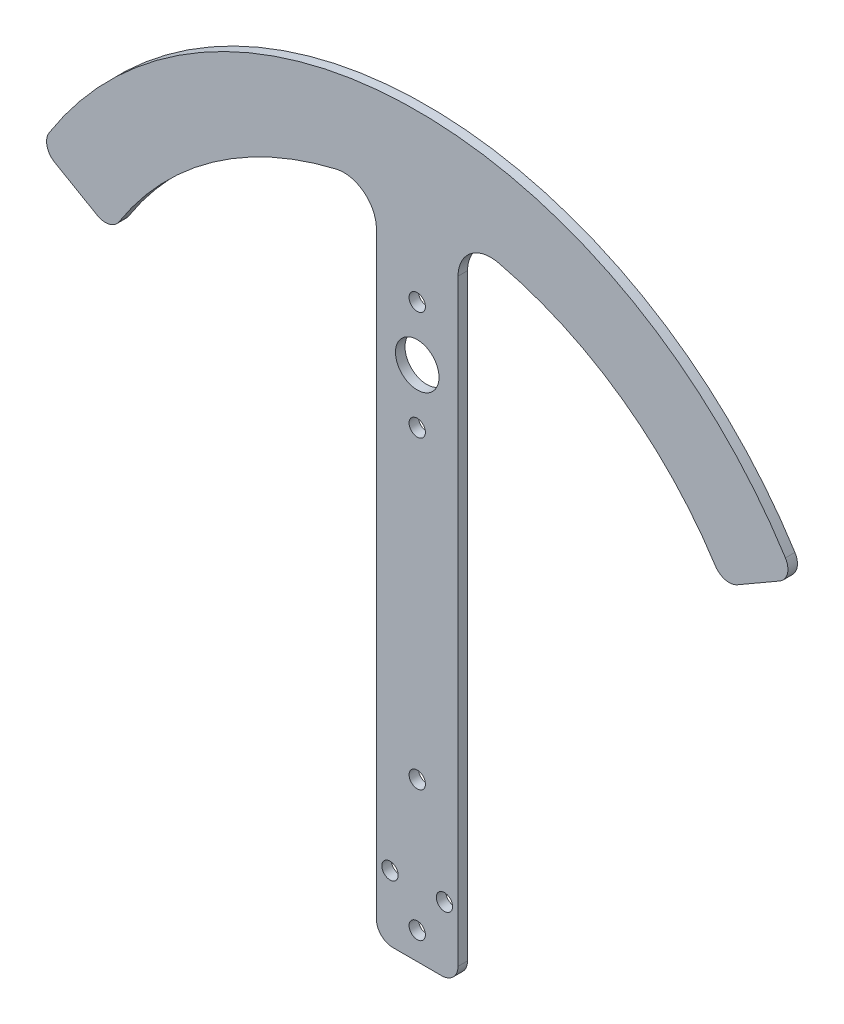
from build123d import *

# Parameters (mm, degrees)
SKETCH_1_W      = 15
SKETCH_1_H      = 120
SKETCH_1_R      = 1.5
SKETCH_1_R_2    = 4
EXTRUDE_1_DEPTH = 1.75
FILLET_1_R      = 3
FILLET_2_R      = 6


with BuildPart() as part:
    # 草图1 → 凸台-拉伸1 (new body)
    # profile 1 of 3: a face of its own
    with BuildSketch(Plane.XY):
        with BuildLine():
            ThreePointArc((56.291651246, 32.5), (0, 65), (-56.291651246, 32.5))
            Line((-56.291651246, 32.5), (-69.282032303, 40))
            ThreePointArc((-69.282032303, 40), (0, 80), (69.282032303, 40))
            Line((69.282032303, 40), (56.291651246, 32.5))
        make_face()
    # profile 2 of 3: a face of its own
    with BuildSketch(Plane.XY):
        with Locations((0, 4.565857851)):
            Rectangle(SKETCH_1_W, SKETCH_1_H)
        with Locations((0, 49.565857851)):
            Circle(SKETCH_1_R, mode=Mode.SUBTRACT)
        with Locations((0, 29.565857851)):
            Circle(SKETCH_1_R, mode=Mode.SUBTRACT)
        with Locations((0, 39.565857851)):
            Circle(SKETCH_1_R_2, mode=Mode.SUBTRACT)
        with Locations((0, -26.434142149)):
            Circle(SKETCH_1_R, mode=Mode.SUBTRACT)
        with Locations((5, -43.434142149)):
            Circle(SKETCH_1_R, mode=Mode.SUBTRACT)
        with Locations((-5, -43.434142149)):
            Circle(SKETCH_1_R, mode=Mode.SUBTRACT)
        with Locations((0, -50.434142149)):
            Circle(SKETCH_1_R, mode=Mode.SUBTRACT)
    # profile 3 of 3: a face of its own
    with BuildSketch(Plane.XY):
        with BuildLine():
            ThreePointArc((7.5, 64.565857851), (0, 65), (-7.5, 64.565857851))
            Line((-7.5, 64.565857851), (7.5, 64.565857851))
        make_face()
    extrude(amount=EXTRUDE_1_DEPTH)

    # 圆角1
    fillet_1_edges = [part.edges().sort_by_distance(p)[0] for p in [
        (7.5, -55.434142149, 0.875),
        (-7.5, -55.434142149, 0.875),
        (-56.291651246, 32.5, 0.875),
        (-69.282032303, 40, 0.875),
        (69.282032303, 40, 0.875),
        (56.291651246, 32.5, 0.875),
    ]]
    fillet(fillet_1_edges, radius=FILLET_1_R)

    # 圆角2
    fillet_2_edges = [part.edges().sort_by_distance(p)[0] for p in [
        (7.5, 64.565857851, 0.875),
        (-7.5, 64.565857851, 0.875),
    ]]
    fillet(fillet_2_edges, radius=FILLET_2_R)


solid = part.part
